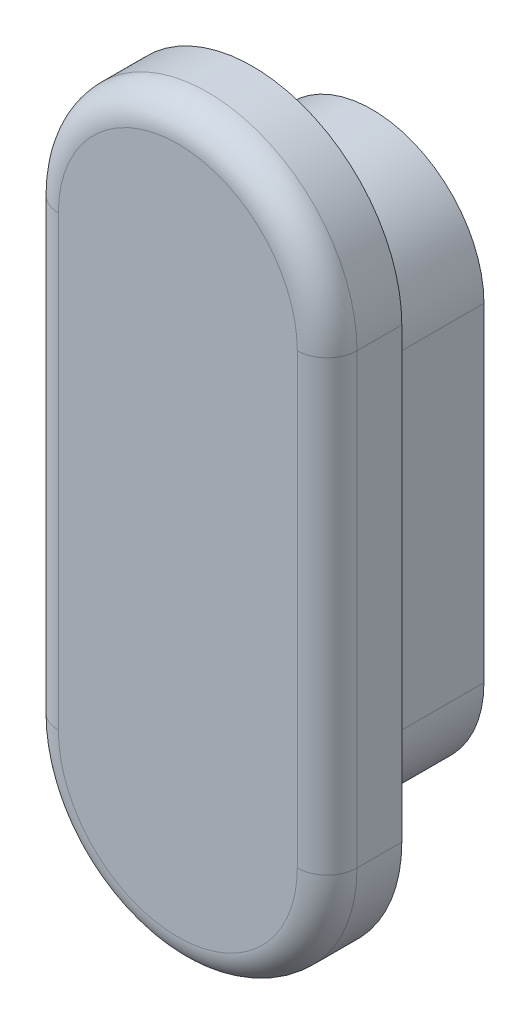
from build123d import *

# Parameters (mm, degrees)
SKETCH_2_R      = 2
EXTRUDE_1_DEPTH = 8
EXTRUDE_2_DEPTH = 5
FILLET_1_R      = 2


with BuildPart() as part:
    # 草图2 → 凸台-拉伸1 (new body)
    with BuildSketch(Plane.XY):
        with BuildLine():
            Line((-7.5, -11), (-7.5, 11))
            ThreePointArc((-7.5, 11), (0, 18.5), (7.5, 11))
            Line((7.5, 11), (7.5, -11))
            ThreePointArc((7.5, -11), (0, -18.5), (-7.5, -11))
        make_face()
        with Locations((0, -11)):
            Circle(SKETCH_2_R, mode=Mode.SUBTRACT)
        with Locations((0, 11)):
            Circle(SKETCH_2_R, mode=Mode.SUBTRACT)
    extrude(amount=EXTRUDE_1_DEPTH)

    # 草图3 → 凸台-拉伸2 (add)
    with BuildSketch(Plane.XY.offset(8)):
        with BuildLine():
            Line((-10, -15), (-10, 15))
            ThreePointArc((-10, 15), (0, 25), (10, 15))
            Line((10, 15), (10, -15))
            ThreePointArc((10, -15), (0, -25), (-10, -15))
        make_face()
    extrude(amount=EXTRUDE_2_DEPTH)

    # 圆角1
    fillet_1_edges = [part.edges().sort_by_distance(p)[0] for p in [
        (0, -25, 13),
        (10, 0, 13),
        (0, 25, 13),
        (-10, 0, 13),
    ]]
    fillet(fillet_1_edges, radius=FILLET_1_R)


solid = part.part
